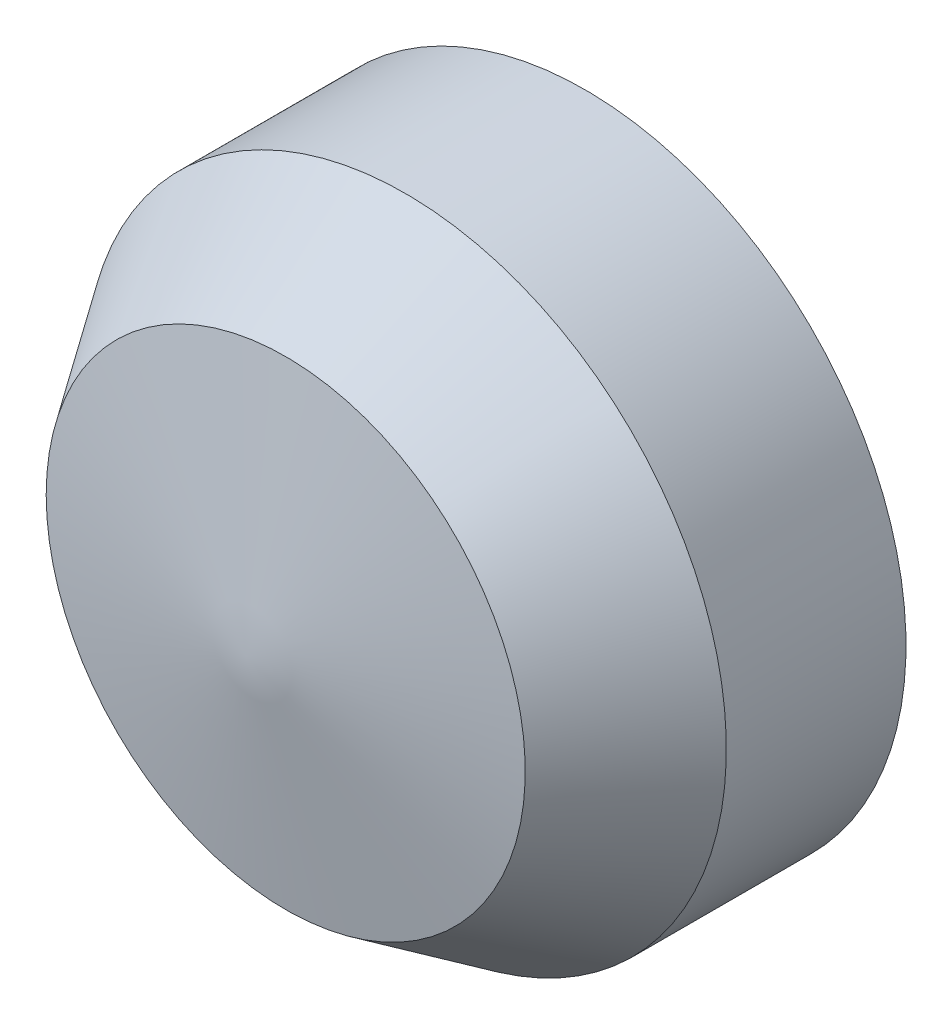
from build123d import *


with BuildPart() as part:
    # Revolve profile 1 → Revolve 1 (revolve)
    with BuildSketch(Plane(origin=(0, 0, 0), x_dir=(1, 0, 0), z_dir=(0, 1, 0)), mode=Mode.PRIVATE) as revolve_1_sk:
        Polygon((0, -34), (0, 0), (32.15, 0), (32.15, -18), (24, -30), align=None)
    revolve(revolve_1_sk.sketch.rotate(Axis((0, 0, -5), (0, 0, 1)), 180), axis=Axis((0, 0, -5), (0, 0, 1)))


solid = part.part
